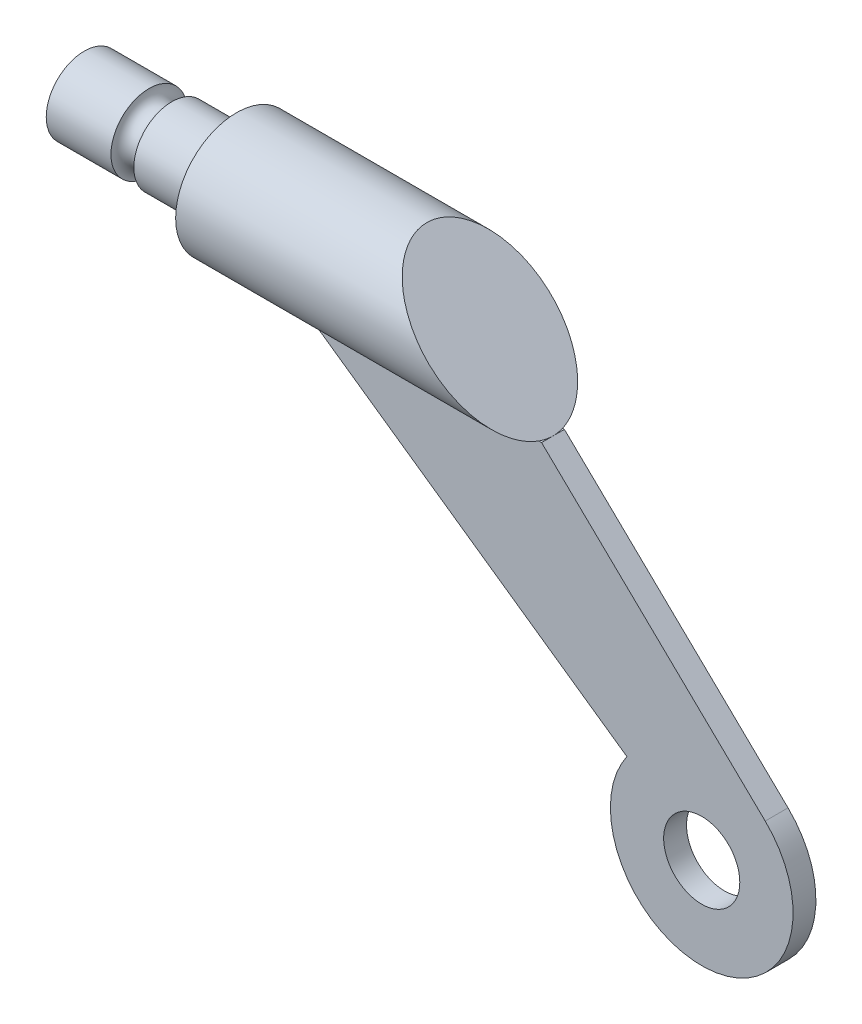
from build123d import *

# Parameters (mm, degrees)
CUT_EXTRUDE_1_DEPTH      = 99.47412047
CUT_EXTRUDE_1_DEPTH_BACK = 99.47412047
SKETCH_3_R               = 12
SKETCH_3_R_2             = 5
EXTRUDE_1_DEPTH          = 1.5


with BuildPart() as part:
    # 草图1 → 旋转1 (revolve)
    with BuildSketch(Plane.XY, mode=Mode.PRIVATE) as revolve_1_sk:
        with BuildLine():
            Line((-82.608428155, 45), (-82.608428155, 50))
            Line((-82.608428155, 50), (-74.103486012, 50))
            ThreePointArc((-74.103486012, 50), (-72.603486012, 48.5), (-71.103486012, 50))
            Line((-71.103486012, 50), (-62.608428155, 50))
            Line((-62.608428155, 50), (-62.608428155, 53))
            Line((-62.608428155, 53), (-20.871531074, 53))
            Line((-20.871531074, 53), (-20.871531074, 45))
            Line((-20.871531074, 45), (-82.608428155, 45))
        make_face()
    revolve(revolve_1_sk.sketch.rotate(Axis((-114.703915619, 45, 0), (1, 0, 0)), 90), axis=Axis((-114.703915619, 45, 0), (1, 0, 0)))

    # 草图2 → 切除-拉伸1 (cut, two sides: drawn at the far end of the back side and taken through both)
    with BuildSketch(Plane.XY.offset(-CUT_EXTRUDE_1_DEPTH_BACK)):
        Polygon((-190.381582795, 200.531320527), (-37.608428155, 53), (8.335900446, 8.632077604), (161.109055085, -138.899242923), (456.171696139, 166.647066356), (104.681058259, 506.077629806), align=None)
    extrude(amount=CUT_EXTRUDE_1_DEPTH + CUT_EXTRUDE_1_DEPTH_BACK, mode=Mode.SUBTRACT)

    # 草图7 → 大小mm 暗销孔2 (revolve, cut)
    with BuildSketch(Plane(origin=(-82.608428155, 45, 0), x_dir=(0, 0, 1), z_dir=(0, 1, 0))):
        Polygon((0, 0), (0, 45), (2.5, 42.5), (2.5, 0), align=None)
    revolve(axis=Axis((-88.958428155, 45, 0), (1, 0, 0)), mode=Mode.SUBTRACT)


with BuildPart() as body_2:
    # 草图3 → 凸台-拉伸1 (new, symmetric)
    # profile 1 of 2: a face of its own
    with BuildSketch(Plane.XY):
        with BuildLine():
            Line((8.335900446, 8.632077604), (-21.039943135, 37))
            Line((-21.039943135, 37), (-52.841476249, 37))
            Line((-52.841476249, 37), (-9.829824531, 6.882917236))
            ThreePointArc((-9.829824531, 6.882917236), (-1.15014903, 11.94475438), (8.335900446, 8.632077604))
        make_face()
    # profile 2 of 2: a face of its own
    with BuildSketch(Plane.XY):
        Circle(SKETCH_3_R)
        Circle(SKETCH_3_R_2, mode=Mode.SUBTRACT)
    extrude(amount=EXTRUDE_1_DEPTH, both=True)


solid = Compound([part.part, body_2.part])
